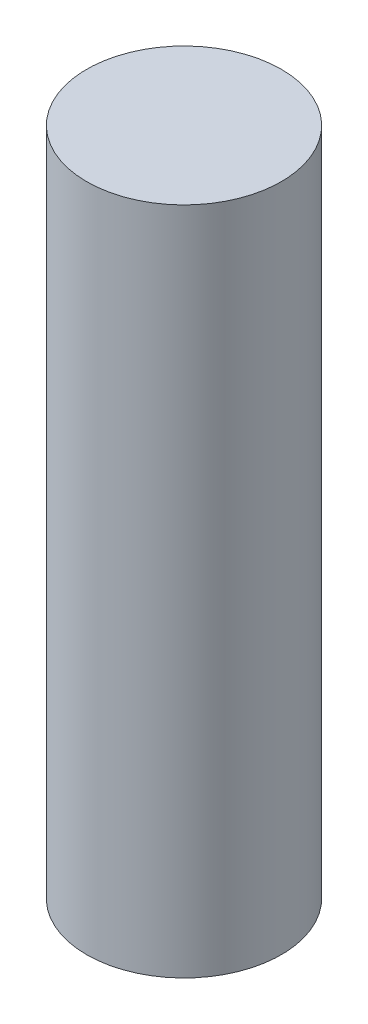
from build123d import *

# Parameters (mm, degrees)
SKETCH1_R           = 6.0198
BOSS_EXTRUDE1_DEPTH = 20.701


with BuildPart() as part:
    # Sketch1 → Boss-Extrude1 (new, symmetric)
    with BuildSketch(Plane(origin=(0, 0, 0), x_dir=(1, 0, 0), z_dir=(0, 1, 0))):
        Circle(SKETCH1_R)
    extrude(amount=BOSS_EXTRUDE1_DEPTH, both=True)


solid = part.part
